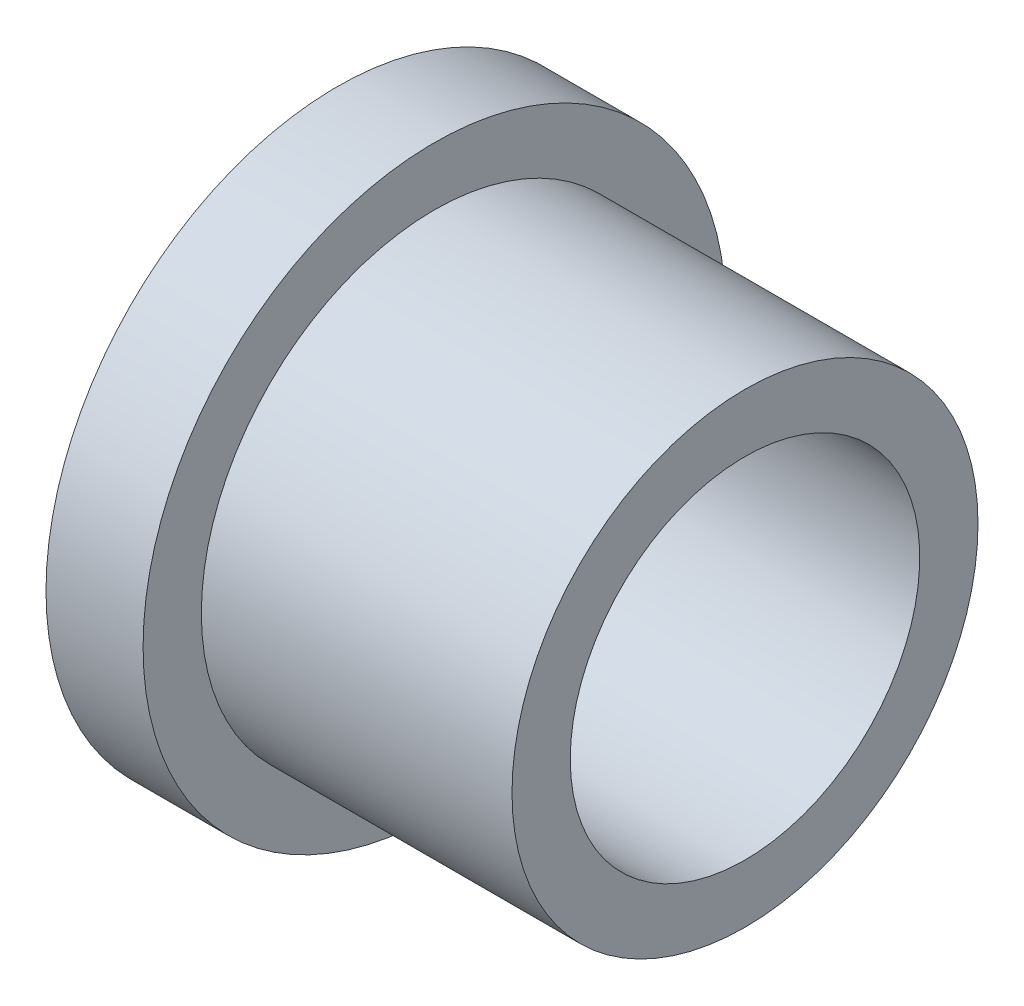
from build123d import *

# Parameters (mm, degrees)
SKETCH1_W = 16
SKETCH1_H = 3


with BuildPart() as part:
    # Sketch1 → Revolve1 (revolve)
    with BuildSketch(Plane.XY, mode=Mode.PRIVATE) as revolve1_sk:
        Polygon((-10.5, 15), (-10.5, 9), (-5.5, 9), (-5.5, 12), (-5.5, 15), align=None)
        with Locations((2.5, 10.5)):
            Rectangle(SKETCH1_W, SKETCH1_H)
    revolve(revolve1_sk.sketch.rotate(Axis((-10.5, 0, 0), (1, 0, 0)), 90), axis=Axis((-10.5, 0, 0), (1, 0, 0)))


solid = part.part
